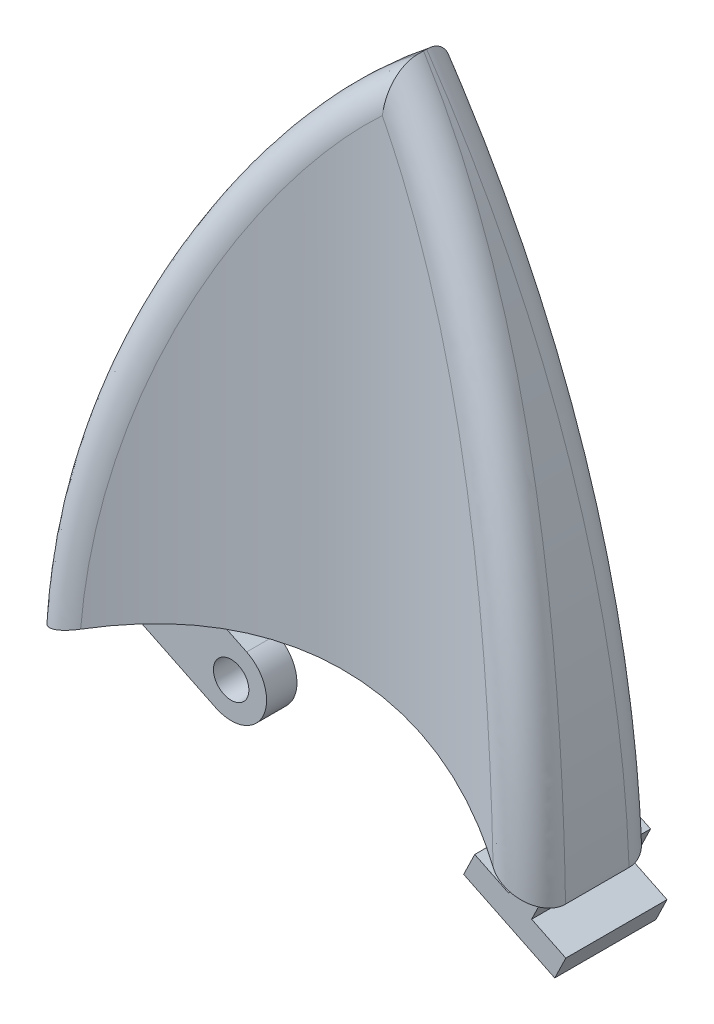
from build123d import *

# Parameters (mm, degrees)
ESBO_O1_W                         = 50
ESBO_O1_H                         = 15
RESSALTO_EXTRUS_O1_DEPTH          = 60
CORTE_EXTRUS_O1_REACH             = 68.708
CORTE_EXTRUS_O1_DIRECTION_2_DEPTH = 67.708320321
CORTE_EXTRUS_O2_REACH             = 68.708
CORTE_EXTRUS_O3_DEPTH             = 60
FILETE1_R                         = 3
CORTE_EXTRUS_O4_REACH             = 68.15
RESSALTO_EXTRUS_O2_DEPTH          = 3
RESSALTO_EXTRUS_O5_DEPTH          = 10
CORTE_EXTRUS_O5_REACH             = 68.436
ESBO_O13_R                        = 1.75


with BuildPart() as part:
    # Esboço1 → Ressalto-extrusão1 (new body)
    with BuildSketch(Plane(origin=(0, 0, 0), x_dir=(1, 0, 0), z_dir=(0, 1, 0))):
        with Locations((0, -7.5)):
            Rectangle(ESBO_O1_W, ESBO_O1_H)
    extrude(amount=RESSALTO_EXTRUS_O1_DEPTH)

    # Esboço2 → Corte-extrusão1 (cut, up to next)
    with BuildSketch(Plane.XY, mode=Mode.PRIVATE) as corte_extrus_o1_sk1:
        with BuildLine():
            Line((5, 60), (25, 60))
            Line((25, 60), (25, 0))
            ThreePointArc((25, 0), (19.26833423, 31.422778077), (5, 60))
        make_face()
    corte_extrus_o1_tool1 = extrude(corte_extrus_o1_sk1.sketch, amount=CORTE_EXTRUS_O1_REACH, mode=Mode.PRIVATE) & part.part
    add(corte_extrus_o1_tool1.solids().sort_by_distance((19.088208, 44.385781, 0))[0], mode=Mode.SUBTRACT)

    # Esboço2 → Corte-extrusão1 direction 2 (cut)
    with BuildSketch(Plane.XY):
        with BuildLine():
            Line((5, 60), (25, 60))
            Line((25, 60), (25, 0))
            ThreePointArc((25, 0), (19.26833423, 31.422778077), (5, 60))
        make_face()
    extrude(amount=-CORTE_EXTRUS_O1_DIRECTION_2_DEPTH, mode=Mode.SUBTRACT)

    # Esboço3 → Corte-extrusão2 (cut, up to next)
    with BuildSketch(Plane(origin=(0, 0, 0), x_dir=(-1, 0, 0), z_dir=(0, 0, -1)), mode=Mode.PRIVATE) as corte_extrus_o2_sk1:
        with BuildLine():
            Line((-5, 60), (25, 60))
            Line((25, 60), (25, 0))
            ThreePointArc((25, 0), (16.592648204, 33.296324102), (-5, 60))
        make_face()
    corte_extrus_o2_tool1 = extrude(corte_extrus_o2_sk1.sketch, amount=-CORTE_EXTRUS_O2_REACH, mode=Mode.PRIVATE) & part.part
    add(corte_extrus_o2_tool1.solids().sort_by_distance((-16.380123, 45.090511, 0))[0], mode=Mode.SUBTRACT)

    # Esboço4 → Corte-extrusão3 (cut)
    with BuildSketch(Plane.XZ):
        with BuildLine():
            Line((-25, 15), (25, 15))
            ThreePointArc((25, 15), (0, 6.224989992), (-25, 15))
        make_face()
    extrude(amount=-CORTE_EXTRUS_O3_DEPTH, mode=Mode.SUBTRACT)

    # Filete1
    filete1_edges = [part.edges().sort_by_distance(p)[0] for p in [
        (19.26833423, 31.422778077, 0),
        (-16.592648204, 33.296324102, 0),
        (-16.624702652, 33.232143265, 9.843411386),
        (19.254067789, 31.465549052, 11.163887998),
    ]]
    fillet(filete1_edges, radius=FILETE1_R)

    # Esboço5 → Corte-extrusão4 (cut, up to next)
    with BuildSketch(Plane.XY, mode=Mode.PRIVATE) as corte_extrus_o4_sk1:
        with BuildLine():
            Line((-25, 0), (25, 0))
            ThreePointArc((25, 0), (0, 6.010205144), (-25, 0))
        make_face()
    corte_extrus_o4_tool1 = extrude(corte_extrus_o4_sk1.sketch, amount=CORTE_EXTRUS_O4_REACH, mode=Mode.PRIVATE) & part.part
    add(corte_extrus_o4_tool1.solids().sort_by_distance((0, 2.415709, 0))[0], mode=Mode.SUBTRACT)

    # Esboço7 → Ressalto-extrusão2 (add)
    with BuildSketch(Plane(origin=(0, 0, 0), x_dir=(-1, 0, 0), z_dir=(0, 0, -1))):
        with BuildLine():
            Line((23.03048945, -3.256985631), (15.834027218, -6.751399938))
            ThreePointArc((15.834027218, -6.751399938), (11.156768732, -5.131753971), (12.7764147, -0.454495485))
            Line((12.7764147, -0.454495485), (19.972876931, 3.039918822))
            ThreePointArc((19.972876931, 3.039918822), (24.650135417, 1.420272855), (23.03048945, -3.256985631))
        make_face()
    extrude(amount=-RESSALTO_EXTRUS_O2_DEPTH)

    # Esboço12 → Ressalto-extrusão5 (add)
    with BuildSketch(Plane(origin=(0, 0, 0), x_dir=(-1, 0, 0), z_dir=(0, 0, -1))):
        Polygon((-24.120879113, 1.357076315), (-22.37367196, -2.241154801), (-25.747013631, -3.879161507), (-24.65500916, -6.128055954), (-15.659431371, -1.760038071), (-16.751435841, 0.488856377), (-20.124777513, -1.14915033), (-21.871984666, 2.449080786), align=None)
    extrude(amount=-RESSALTO_EXTRUS_O5_DEPTH)

    # Esboço13 → Corte-extrusão5 (cut, up to next)
    with BuildSketch(Plane(origin=(0, 0, 0), x_dir=(-1, 0, 0), z_dir=(0, 0, -1)), mode=Mode.PRIVATE) as corte_extrus_o5_sk1:
        with Locations((14.305220959, -3.602947712)):
            Circle(ESBO_O13_R)
    corte_extrus_o5_tool1 = extrude(corte_extrus_o5_sk1.sketch, amount=-CORTE_EXTRUS_O5_REACH, mode=Mode.PRIVATE) & part.part
    add(corte_extrus_o5_tool1.solids().sort_by_distance((-14.305221, -3.602948, 0))[0], mode=Mode.SUBTRACT)


solid = part.part
